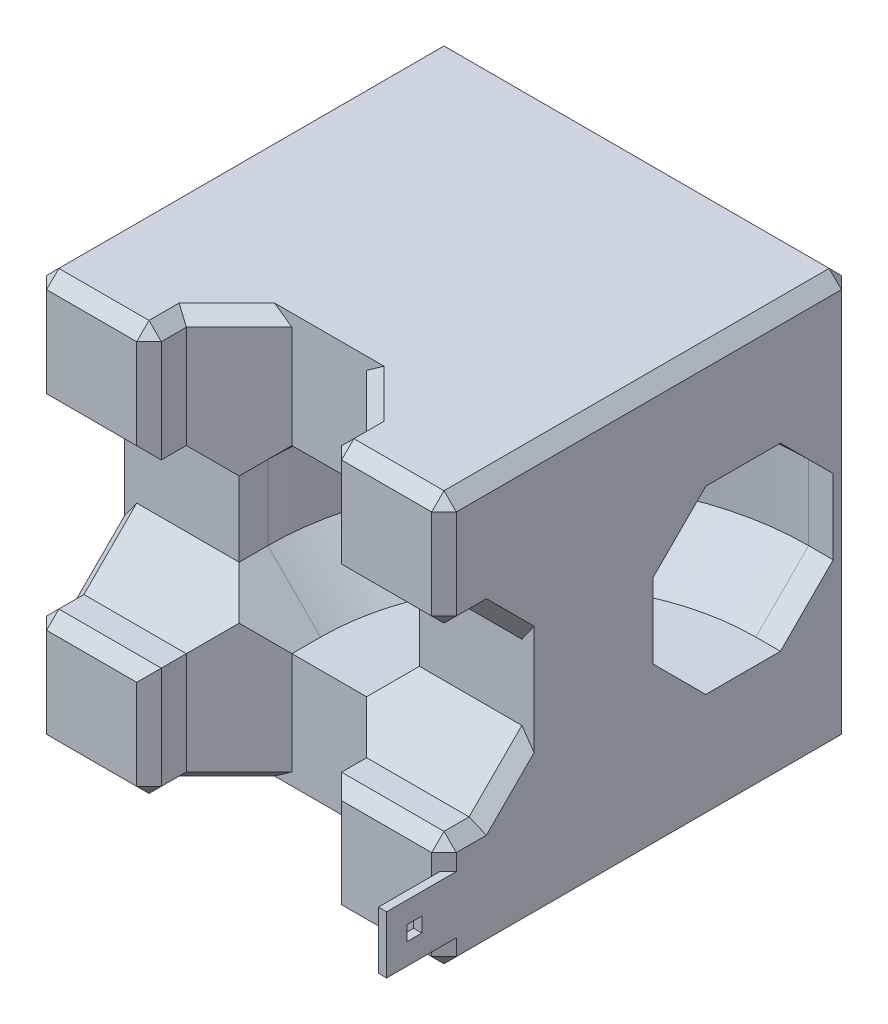
from build123d import *

# Parameters (mm, degrees)
SKETCH1_W                = 50
SKETCH1_H                = 50
BOSS_EXTRUDE1_DEPTH      = 50
CUT_EXTRUDE3_DEPTH       = 87.602540378
CUT_EXTRUDE4_DEPTH       = 87.602540378
CHAMFER1_SIZE            = 1.5
BOSS_EXTRUDE2_DEPTH      = 7
BOSS_EXTRUDE2_DEPTH_BACK = 10
SKETCH10_W               = 1
SKETCH10_H               = 7
SKETCH11_W               = 1.8
SKETCH11_H               = 1.8
CUT_EXTRUDE5_DEPTH       = 7


with BuildPart() as part:
    # Sketch1 → Boss-Extrude1 (new body)
    with BuildSketch(Plane.XY):
        with Locations((25, 25)):
            Rectangle(SKETCH1_W, SKETCH1_H)
    extrude(amount=BOSS_EXTRUDE1_DEPTH)

    # Sketch2 → Cut-Extrude3 (cut, through all)
    with BuildSketch(Plane.ZX):
        Polygon((61, 29.556349186), (54.556349186, 36), (45.443650814, 36), (39, 29.556349186), (39, 20.443650814), (45.443650814, 14), (54.556349186, 14), (61, 20.443650814), align=None)
    extrude(amount=CUT_EXTRUDE3_DEPTH, mode=Mode.SUBTRACT)

    # Sketch6 → Cut-Extrude4 (cut, through all)
    with BuildSketch(Plane(origin=(0, 0, 0), x_dir=(0, 0, -1), z_dir=(1, 0, 0))):
        Polygon((-61, 29.556349186), (-61, 20.443650814), (-54.556349186, 14), (-45.443650814, 14), (-39, 20.443650814), (-39, 29.556349186), (-45.443650814, 36), (-54.556349186, 36), align=None)
    extrude(amount=CUT_EXTRUDE4_DEPTH, mode=Mode.SUBTRACT)

    # Cut-Sweep5: sweep along a path in Sketch9
    with BuildLine(Plane(origin=(0, 25, 0), x_dir=(-1, 0, 0), z_dir=(0, -1, 0))) as cut_sweep5_path:
        Line((-50, -13.5), (-47, -13.5))
        ThreePointArc((-47, -13.5), (-31.443650814, -19.943650814), (-25, -35.5))
        Line((-25, -35.5), (-25, -50))
    # Sketch8 → Cut-Sweep5 (sweep, cut)
    with BuildSketch(Plane(origin=(50, 0, 0), x_dir=(0, 0, -1), z_dir=(1, 0, 0))):
        Polygon((-2.5, 29.556349186), (-8.943650814, 36), (-18.056349186, 36), (-24.5, 29.556349186), (-24.5, 20.443650814), (-18.056349186, 14), (-8.943650814, 14), (-2.5, 20.443650814), align=None)
    sweep(path=cut_sweep5_path.line, mode=Mode.SUBTRACT)

    # Chamfer1
    chamfer1_edges = [part.edges().sort_by_distance(p)[0] for p in [
        (50, 7, 50),
        (43, 50, 50),
        (43, 0, 50),
        (7, 50, 50),
        (14, 43, 50),
        (36, 7, 50),
        (36, 0, 47.721825407),
        (14, 0, 47.721825407),
        (14, 50, 47.721825407),
        (36, 50, 47.721825407),
        (32.778174593, 50, 42.221825407),
        (17.221825407, 50, 42.221825407),
        (32.778174593, 0, 42.221825407),
        (17.221825407, 0, 42.221825407),
        (0, 43, 50),
        (25, 50, 0),
        (50, 25, 0),
        (14, 7, 50),
        (36, 43, 50),
        (50, 43, 50),
        (25, 0, 0),
        (0, 7, 50),
        (0, 25, 0),
        (50, 36, 47.721825407),
        (50, 14, 47.721825407),
        (50, 17.221825407, 42.221825407),
        (50, 32.778174593, 42.221825407),
        (0, 14, 47.721825407),
        (0, 36, 47.721825407),
        (43, 14, 50),
        (7, 14, 50),
        (0, 17.221825407, 42.221825407),
        (0, 32.778174593, 42.221825407),
        (43, 36, 50),
        (7, 36, 50),
        (7, 0, 50),
        (0, 50, 25),
        (50, 50, 25),
        (50, 0, 25),
        (0, 0, 25),
    ]]
    chamfer(chamfer1_edges, length=CHAMFER1_SIZE)

    # Sketch10 → Boss-Extrude2 (add, two sides: drawn at the far end of the back side and taken through both)
    with BuildSketch(Plane.XY.offset(50).offset(-BOSS_EXTRUDE2_DEPTH_BACK)):
        with Locations((49.5, 7)):
            Rectangle(SKETCH10_W, SKETCH10_H)
    extrude(amount=BOSS_EXTRUDE2_DEPTH + BOSS_EXTRUDE2_DEPTH_BACK)

    # Sketch11 → Cut-Extrude5 (cut)
    with BuildSketch(Plane(origin=(50, 0, 0), x_dir=(0, 0, -1), z_dir=(1, 0, 0))):
        with Locations((-53.6, 7)):
            Rectangle(SKETCH11_W, SKETCH11_H)
    extrude(amount=-CUT_EXTRUDE5_DEPTH, mode=Mode.SUBTRACT)


solid = part.part
